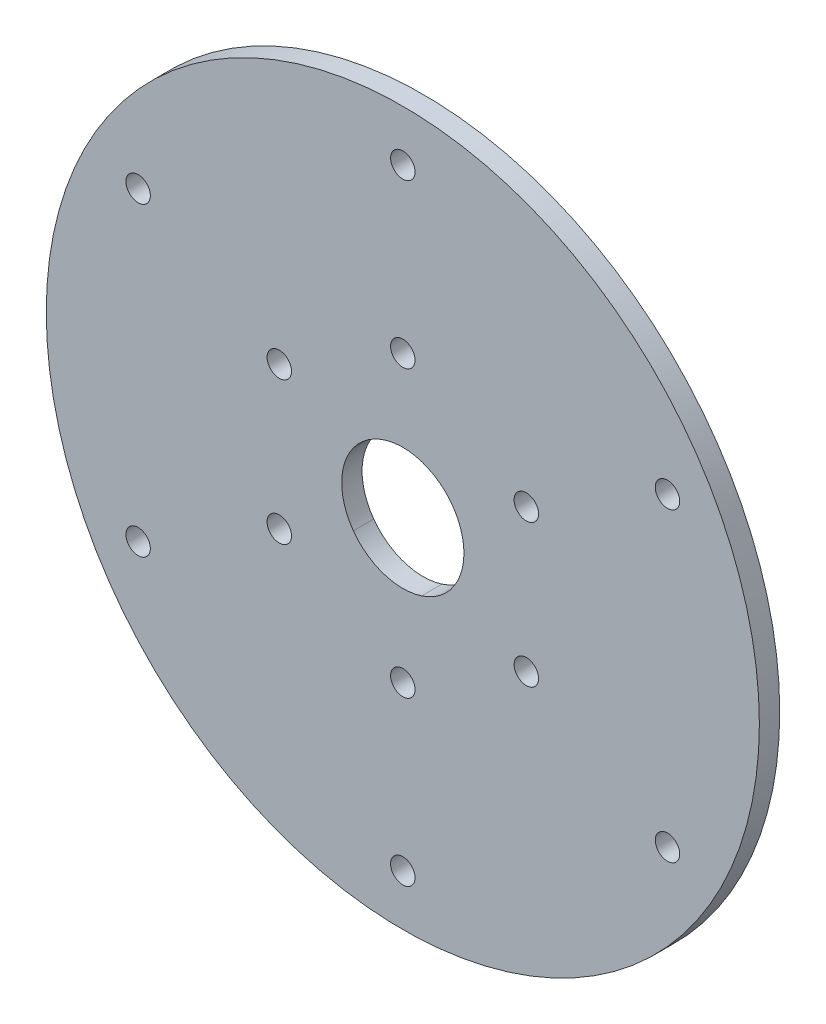
from build123d import *

# Parameters (mm, degrees)
SKETCH1_R           = 175
BOSS_EXTRUDE2_DEPTH = 10
SKETCH2_R           = 6
CUT_EXTRUDE1_DEPTH  = 248.68932153
CIRPATTERN2_COUNT   = 6


with BuildPart() as part:
    # Sketch1 → Boss-Extrude2 (new body)
    with BuildSketch(Plane.XY):
        Circle(SKETCH1_R)
        with BuildLine():
            ThreePointArc((30.001118034, 0.000363271), (24.271455118, -17.633432061), (9.271068846, -28.531513848))
            ThreePointArc((9.271068846, -28.531513848), (-9.270509831, -28.531695489), (-24.270855318, -17.633082037))
            ThreePointArc((-24.270855318, -17.633082037), (-30.000690983, 0.000951057), (-24.270855318, 17.63498415))
            ThreePointArc((-24.270855318, 17.63498415), (-9.270509831, 28.533597602), (9.271068846, 28.533415961))
            ThreePointArc((9.271068846, 28.533415961), (24.271455118, 17.635334174), (30.001118034, 0.001538842))
            ThreePointArc((30.001118034, 0.001538842), (30.001118028, 0.000951057), (30.001118011, 0.000363271))
        make_face(mode=Mode.SUBTRACT)
    extrude(amount=BOSS_EXTRUDE2_DEPTH)

    # Sketch2 → Cut-Extrude1 (cut, through all)
    with BuildSketch(Plane(origin=(0, 0, 0), x_dir=(-1, 0, 0), z_dir=(0, 0, -1))):
        with Locations((0, 70)):
            Circle(SKETCH2_R)
        with Locations((0, 150)):
            Circle(SKETCH2_R)
    cut_extrude1 = extrude(amount=-CUT_EXTRUDE1_DEPTH, mode=Mode.SUBTRACT)

    # CirPattern2: Cut-Extrude1 ×6 about axis
    cirpattern2_axis = Axis((0, 0, 0), (0, 0, 1))
    for i in range(1, CIRPATTERN2_COUNT):
        add(cut_extrude1.rotate(cirpattern2_axis, i * 360 / CIRPATTERN2_COUNT), mode=Mode.SUBTRACT)


solid = part.part
